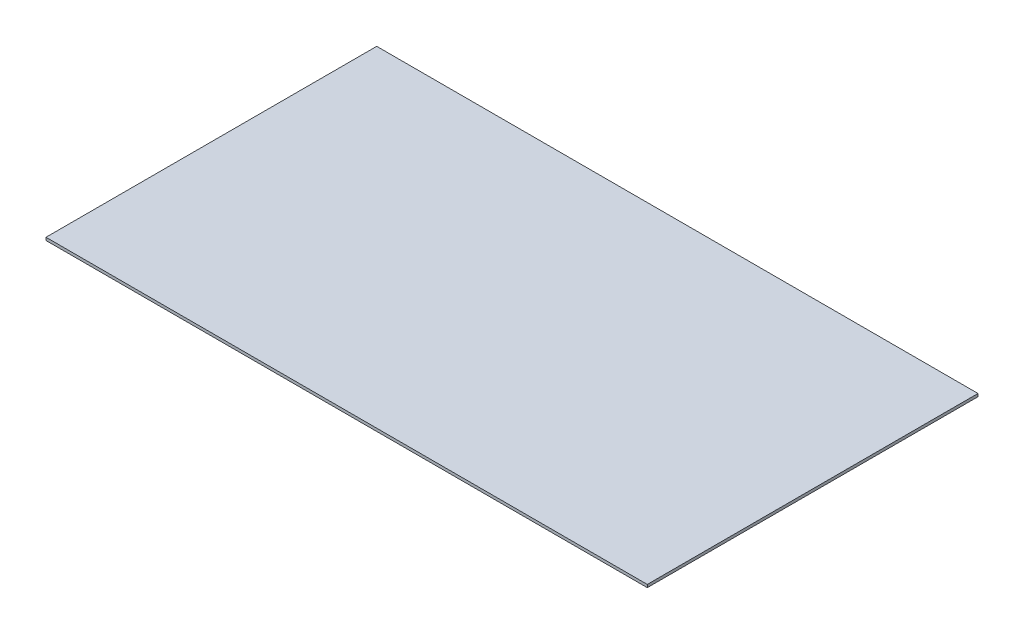
from build123d import *

# Parameters (mm, degrees)
SKETCH1_W           = 2540
SKETCH1_H           = 1397
BOSS_EXTRUDE1_DEPTH = 12


with BuildPart() as part:
    # Sketch1 → Boss-Extrude1 (new body)
    with BuildSketch(Plane(origin=(0, 0, 0), x_dir=(1, 0, 0), z_dir=(0, 1, 0))):
        Rectangle(SKETCH1_W, SKETCH1_H)
    extrude(amount=BOSS_EXTRUDE1_DEPTH)


solid = part.part
